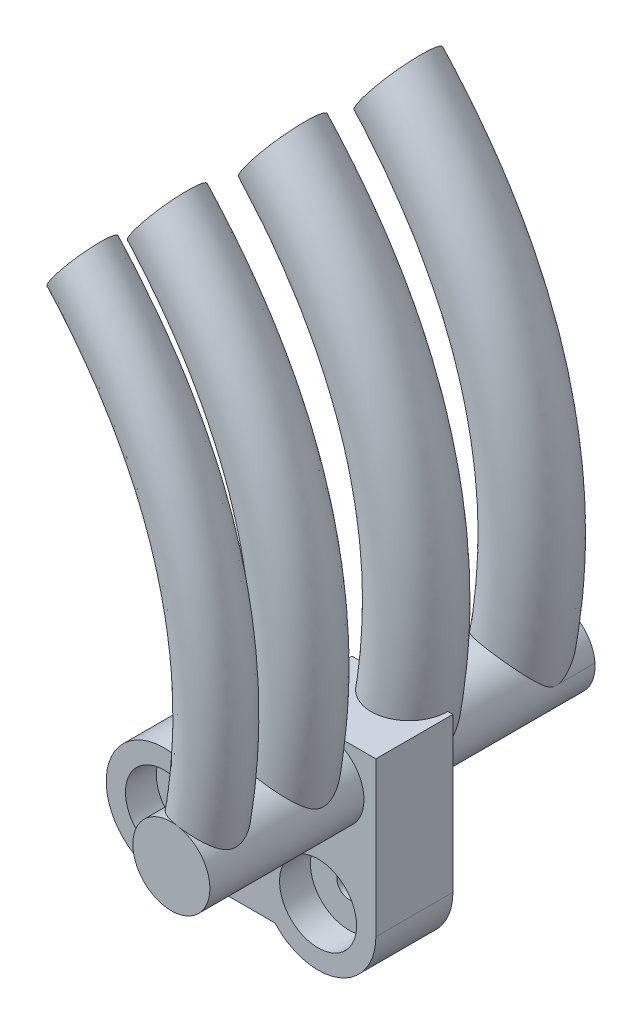
from build123d import *

# Parameters (mm, degrees)
SKETCH1_R           = 1.55
BOSS_EXTRUDE1_DEPTH = 5
SKETCH2_R           = 5
CUT_EXTRUDE1_DEPTH  = 4
CUT_EXTRUDE3_START  = -4
SKETCH5_R           = 5
CUT_EXTRUDE3_DEPTH  = 4
BOSS_EXTRUDE2_START = -10
BOSS_EXTRUDE2_DEPTH = 10
SKETCH7_R           = 5
BOSS_EXTRUDE3_DEPTH = 25
SKETCH8_R           = 5
SKETCH8_R_2         = 4.5
SKETCH8_R_3         = 4
SKETCH10_R          = 5
CUT_EXTRUDE4_DEPTH  = 4


with BuildPart() as part:
    # Sketch1 → Boss-Extrude1 (new, symmetric)
    with BuildSketch(Plane.XY):
        with BuildLine():
            Line((4.409830056, -5), (-4.409830056, -5))
            ThreePointArc((-4.409830056, -5), (-17.5, 0), (-4.409830056, 5))
            Line((-4.409830056, 5), (4.409830056, 5))
            ThreePointArc((4.409830056, 5), (17.5, 0), (4.409830056, -5))
        make_face()
        with Locations((-10, 0)):
            Circle(SKETCH1_R, mode=Mode.SUBTRACT)
        with Locations((10, 0)):
            Circle(SKETCH1_R, mode=Mode.SUBTRACT)
    extrude(amount=BOSS_EXTRUDE1_DEPTH, both=True)

    # Sketch2 → Cut-Extrude1 (cut)
    with BuildSketch(Plane.XY.offset(5)):
        with Locations((10, 0)):
            Circle(SKETCH2_R)
    extrude(amount=-CUT_EXTRUDE1_DEPTH, mode=Mode.SUBTRACT)

    # Sketch5 → Cut-Extrude3 (cut)
    with BuildSketch(Plane(origin=(0, 0, -5), x_dir=(-1, 0, 0), z_dir=(0, 0, -1)).offset(CUT_EXTRUDE3_START)):
        with Locations(Location((-10, 0, 0), (0, 0, 180))):
            Circle(SKETCH5_R)
    extrude(amount=CUT_EXTRUDE3_DEPTH, mode=Mode.SUBTRACT)

    # Sketch6 → Boss-Extrude2 (add)
    with BuildSketch(Plane(origin=(0, 0, -5), x_dir=(-1, 0, 0), z_dir=(0, 0, -1)).offset(BOSS_EXTRUDE2_START)):
        with BuildLine():
            Line((-17.5, 20), (-17.5, 0))
            ThreePointArc((-17.5, 0), (-12.676165673, 7.006292692), (-4.409830056, 5))
            Line((-4.409830056, 5), (-4.409830056, 20))
            Line((-4.409830056, 20), (-17.5, 20))
        make_face()
    extrude(amount=BOSS_EXTRUDE2_DEPTH)

    # Sketch7 → Boss-Extrude3 (add, symmetric)
    with BuildSketch(Plane.XY):
        with Locations((10.954915028, 14.645828645)):
            Circle(SKETCH7_R)
    extrude(amount=BOSS_EXTRUDE3_DEPTH, both=True)

    # Sweep1: sweep along a path in Sketch9
    with BuildLine() as sweep1_path:  # in the path sketch's own coordinates; laid on its plane below (add() does not lay a ready-made edge on the line's plane)
        add(Edge.make_bspline(
            [(10.954915028, 15), (18.238943146, 47.876881482), (-4.574227678, 72.955549577)],
            knots=[0, 0, 0, 1, 1, 1], degree=2))
    # Sketch8 → Sweep1 (sweep)
    with BuildSketch(Plane(origin=(0, 15, 0), x_dir=(1, 0, 0), z_dir=(0, 1, 0))):
        with Locations((10.954915028, 20)):
            Circle(SKETCH8_R)
        with Locations((10.954915028, 5)):
            Circle(SKETCH8_R)
        with Locations((10.954915028, -10)):
            Circle(SKETCH8_R_2)
        with Locations((10.954915028, -21)):
            Circle(SKETCH8_R_3)
    sweep(path=Plane.XY * sweep1_path.line)

    # Sketch10 → Cut-Extrude4 (cut)
    with BuildSketch(Plane.XY.offset(5)):
        with Locations((-10, 0)):
            Circle(SKETCH10_R)
    extrude(amount=-CUT_EXTRUDE4_DEPTH, mode=Mode.SUBTRACT)


solid = part.part
